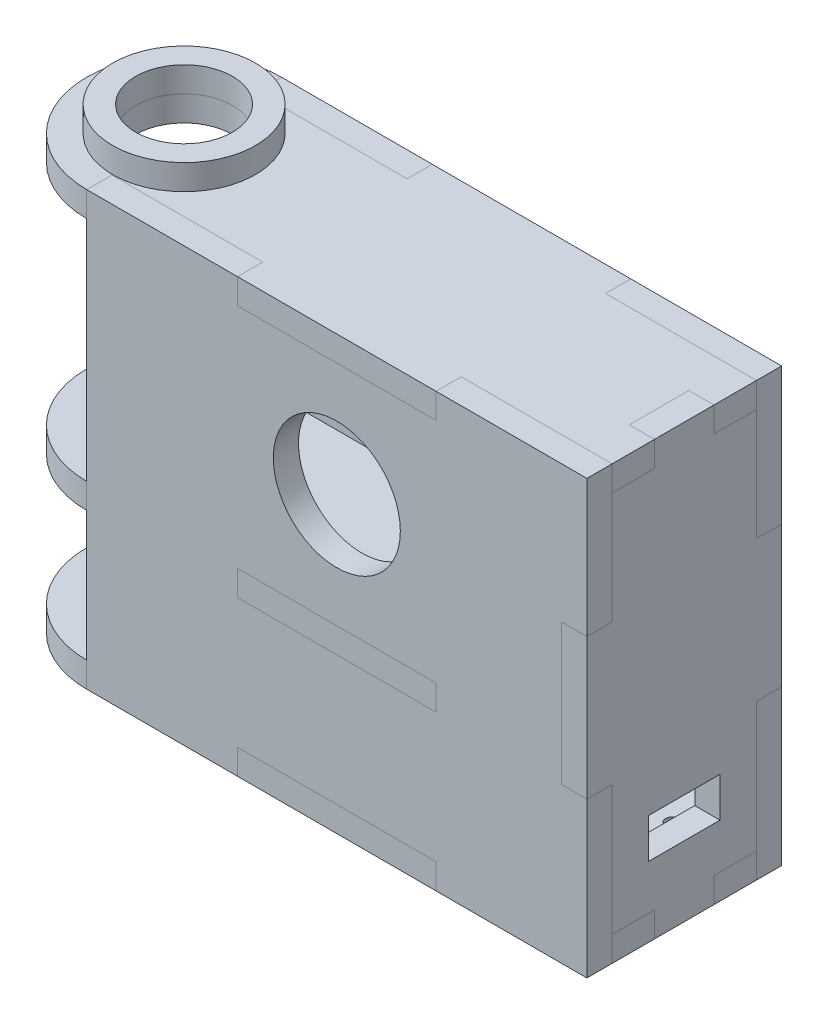
from build123d import *

# Parameters (mm, degrees)
SKETCH_3_R               = 8
EXTRUDE_2_DEPTH          = 3.175
PATTERN_LINEAR_1_COUNT   = 2
PATTERN_LINEAR_1_PITCH   = 21.35
SKETCH_4_W               = 25
SKETCH_4_H               = 3.175
CUT_EXTRUDE_1_DEPTH      = 55.430925263
SKETCH_5_W               = 25
SKETCH_5_H               = 3.175
EXTRUDE_3_DEPTH          = 3.175
EXTRUDE_4_DEPTH          = 3.175
SKETCH_7_W               = 25
SKETCH_7_H               = 3.175
SKETCH_7_W_2             = 3.175
SKETCH_7_H_2             = 5.3375
EXTRUDE_5_DEPTH          = 3.175
EXTRUDE_6_DEPTH          = 3.175
SKETCH_12_R              = 0.795
SKETCH_12_W              = 35.7
SKETCH_12_H              = 15.2
CUT_EXTRUDE_2_DEPTH      = 74.083711634
SKETCH_14_R              = 0.795
SKETCH_14_W              = 35.7
SKETCH_14_H              = 15.2
EXTRUDE_9_DEPTH          = 3.175
SKETCH_9_R               = 9
EXTRUDE_7_DEPTH          = 3.175
SKETCH_10_R              = 9
EXTRUDE_8_DEPTH          = 3.175
SKETCH_15_R              = 6.1
CUT_EXTRUDE_3_DEPTH      = 78.933955413
CUT_EXTRUDE_4_DEPTH      = 88.944852216
CUT_EXTRUDE_4_DEPTH_BACK = 88.944852216
SKETCH_16_W              = 9
SKETCH_16_H              = 5


with BuildPart() as part:
    # 草图3 → 凸台-拉伸2 (new body)
    with BuildSketch(Plane.XY):
        Polygon((31.5, 0.25), (31.5, 17.5), (12.5, 17.5), (12.5, 14.325), (-12.5, 14.325), (-12.5, 17.5), (-31.5, 17.5), (-31.5, -37), (-12.5, -37), (-12.5, -33.825), (12.5, -33.825), (12.5, -37), (31.5, -37), (31.5, -17.5), (28.325, -17.5), (28.325, 0.25), align=None)
        Circle(SKETCH_3_R, mode=Mode.SUBTRACT)
    extrude(amount=EXTRUDE_2_DEPTH)


with BuildPart() as pattern_linear_1_1:
    # 阵列(线性)1: pattern copy
    add(part.part.moved(Location(Vector(0, 0, -1) * (1 * PATTERN_LINEAR_1_PITCH))))


with BuildPart() as cut_extrude_1_tool:
    # 草图4 → 切除-拉伸1 (new, through all)
    with BuildSketch(Plane(origin=(0, 0, -21.35), x_dir=(-1, 0, 0), z_dir=(0, 0, -1))):
        with Locations((0, -15.9125)):
            Rectangle(SKETCH_4_W, SKETCH_4_H)
    extrude(amount=-CUT_EXTRUDE_1_DEPTH)


with BuildPart() as part_1:
    add(part.part)

    # 切除-拉伸1: cut by cut_extrude_1_tool
    add(cut_extrude_1_tool.part, mode=Mode.SUBTRACT)


with BuildPart() as pattern_linear_1_1_1:
    add(pattern_linear_1_1.part)

    # 切除-拉伸1: cut by cut_extrude_1_tool
    add(cut_extrude_1_tool.part, mode=Mode.SUBTRACT)


with BuildPart() as body_3:
    # 草图5 → 凸台-拉伸3 (new body)
    with BuildSketch(Plane(origin=(0, 14.325, 0), x_dir=(1, 0, 0), z_dir=(0, 1, 0))):
        Polygon((-12.5, 18.175), (-31.5, 18.175), (-31.5, 0), (-12.5, 0), (12.5, 0), (31.5, 0), (31.5, 5.3375), (28.325, 5.3375), (28.325, 12.8375), (31.5, 12.8375), (31.5, 18.175), (12.5, 18.175), align=None)
        with BuildLine():
            ThreePointArc((-31.5, -3.175), (-43.7625, 9.0875), (-31.5, 21.35))
            Line((-31.5, 21.35), (-31.5, -3.175))
        make_face()
        with Locations((0, 19.7625)):
            Rectangle(SKETCH_5_W, SKETCH_5_H)
        with Locations((0, -1.5875)):
            Rectangle(SKETCH_5_W, SKETCH_5_H)
    extrude(amount=EXTRUDE_3_DEPTH)


with BuildPart() as body_4:
    # 草图6 → 凸台-拉伸4 (new body)
    with BuildSketch(Plane.XZ.offset(14.325)):
        with BuildLine():
            Line((28.325, 0), (12.5, 0))
            Line((12.5, 0), (12.5, 3.175))
            Line((12.5, 3.175), (-12.5, 3.175))
            Line((-12.5, 3.175), (-12.5, 0))
            Line((-12.5, 0), (-31.5, 0))
            Line((-31.5, 0), (-31.5, 3.175))
            ThreePointArc((-31.5, 3.175), (-43.7625, -9.0875), (-31.5, -21.35))
            Line((-31.5, -21.35), (-31.5, -18.175))
            Line((-31.5, -18.175), (-12.5, -18.175))
            Line((-12.5, -18.175), (-12.5, -21.35))
            Line((-12.5, -21.35), (12.5, -21.35))
            Line((12.5, -21.35), (12.5, -18.175))
            Line((12.5, -18.175), (28.325, -18.175))
            Line((28.325, -18.175), (28.325, 0))
        make_face()
    extrude(amount=EXTRUDE_4_DEPTH)


with BuildPart() as body_5:
    # 草图7 → 凸台-拉伸5 (new body)
    with BuildSketch(Plane.XZ.offset(33.825)):
        with BuildLine():
            Line((-31.5, 0), (-31.5, 3.175))
            ThreePointArc((-31.5, 3.175), (-43.7625, -9.0875), (-31.5, -21.35))
            Line((-31.5, -21.35), (-31.5, -18.175))
            Line((-31.5, -18.175), (-12.5, -18.175))
            Line((-12.5, -18.175), (-12.5, -21.35))
            Line((-12.5, -21.35), (12.5, -21.35))
            Line((12.5, -21.35), (12.5, -18.175))
            Line((12.5, -18.175), (28.325, -18.175))
            Line((28.325, -18.175), (28.325, 0))
            Line((28.325, 0), (12.5, 0))
            Line((12.5, 0), (-12.5, 0))
            Line((-12.5, 0), (-31.5, 0))
        make_face()
        with Locations((0, 1.5875)):
            Rectangle(SKETCH_7_W, SKETCH_7_H)
        with Locations((29.9125, -2.66875)):
            Rectangle(SKETCH_7_W_2, SKETCH_7_H_2)
        with Locations((29.9125, -15.50625)):
            Rectangle(SKETCH_7_W_2, SKETCH_7_H_2)
    extrude(amount=EXTRUDE_5_DEPTH)

    # 草图12 → 切除-拉伸2 (cut, through all)
    with BuildSketch(Plane.XZ.offset(37)):
        with Locations(Location((26.204472492, -5.3375, 0), (0, 0, 270))):
            Circle(SKETCH_12_R)
        with Locations(Location((26.204472492, -12.8375, 0), (0, 0, 270))):
            Circle(SKETCH_12_R)
        with Locations(Location((-16.395527508, -12.8375, 0), (0, 0, 270))):
            Circle(SKETCH_12_R)
        with Locations(Location((-16.395527508, -5.3375, 0), (0, 0, 270))):
            Circle(SKETCH_12_R)
        with Locations((4.904472492, -9.0875)):
            Rectangle(SKETCH_12_W, SKETCH_12_H)
    extrude(amount=-CUT_EXTRUDE_2_DEPTH, mode=Mode.SUBTRACT)


with BuildPart() as body_6:
    # 草图8 → 凸台-拉伸6 (new body)
    with BuildSketch(Plane(origin=(28.325, 0, 0), x_dir=(0, 0, -1), z_dir=(1, 0, 0))):
        Polygon((12.8375, -37), (12.8375, -33.825), (18.175, -33.825), (18.175, -17.5), (21.35, -17.5), (21.35, 0.25), (18.175, 0.25), (18.175, 14.325), (12.8375, 14.325), (12.8375, 17.5), (5.3375, 17.5), (5.3375, 14.325), (0, 14.325), (0, 0.25), (-3.175, 0.25), (-3.175, -17.5), (0, -17.5), (0, -33.825), (5.3375, -33.825), (5.3375, -37), align=None)
    extrude(amount=EXTRUDE_6_DEPTH)

    # 草图16 → 切除-拉伸4 (cut, two sides: drawn at the far end of the back side and taken through both)
    with BuildSketch(Plane(origin=(31.5, 0, 0), x_dir=(0, 0, -1), z_dir=(1, 0, 0)).offset(-CUT_EXTRUDE_4_DEPTH_BACK)):
        with Locations((9.0875, -25.6625)):
            Rectangle(SKETCH_16_W, SKETCH_16_H)
    extrude(amount=CUT_EXTRUDE_4_DEPTH + CUT_EXTRUDE_4_DEPTH_BACK, mode=Mode.SUBTRACT)


with BuildPart() as body_7:
    # 草图14 → 凸台-拉伸9 (new body)
    with BuildSketch(Plane(origin=(0, -33.825, 0), x_dir=(1, 0, 0), z_dir=(0, 1, 0))):
        Polygon((28.325, 12.8375), (28.325, 18.175), (12.5, 18.175), (-12.5, 18.175), (-18.516055016, 18.175), (-18.516055016, 12.8375), (-18.516055016, 5.3375), (-18.516055016, 0), (-12.5, 0), (12.5, 0), (28.325, 0), (28.325, 5.3375), align=None)
        with Locations(Location((-16.395527508, 5.3375, 0), (0, 0, 270))):
            Circle(SKETCH_14_R, mode=Mode.SUBTRACT)
        with Locations((4.904472492, 9.0875)):
            Rectangle(SKETCH_14_W, SKETCH_14_H, mode=Mode.SUBTRACT)
        with Locations(Location((26.204472492, 5.3375, 0), (0, 0, 270))):
            Circle(SKETCH_14_R, mode=Mode.SUBTRACT)
        with Locations(Location((-16.395527508, 12.8375, 0), (0, 0, 270))):
            Circle(SKETCH_14_R, mode=Mode.SUBTRACT)
        with Locations(Location((26.204472492, 12.8375, 0), (0, 0, 270))):
            Circle(SKETCH_14_R, mode=Mode.SUBTRACT)
    extrude(amount=EXTRUDE_9_DEPTH)


with BuildPart() as body_8:
    # 草图9 → 凸台-拉伸7 (new body)
    with BuildSketch(Plane(origin=(0, 17.5, 0), x_dir=(1, 0, 0), z_dir=(0, 1, 0))):
        with Locations(Location((-31.5, 9.0875, 0), (0, 0, 180))):
            Circle(SKETCH_9_R)
    extrude(amount=EXTRUDE_7_DEPTH)


with BuildPart() as body_9:
    # 草图10 → 凸台-拉伸8 (new body)
    with BuildSketch(Plane.XZ.offset(37)):
        with Locations(Location((-31.5, -9.0875, 0), (0, 0, 270))):
            Circle(SKETCH_10_R)
    extrude(amount=EXTRUDE_8_DEPTH)


with BuildPart() as cut_extrude_3_tool:
    # 草图15 → 切除-拉伸3 (new, through all)
    with BuildSketch(Plane(origin=(0, 20.675, 0), x_dir=(1, 0, 0), z_dir=(0, 1, 0))):
        with Locations(Location((-31.5, 9.0875, 0), (0, 0, 180))):
            Circle(SKETCH_15_R)
    extrude(amount=-CUT_EXTRUDE_3_DEPTH)


with BuildPart() as body_3_1:
    add(body_3.part)

    # 切除-拉伸3: cut by cut_extrude_3_tool
    add(cut_extrude_3_tool.part, mode=Mode.SUBTRACT)


with BuildPart() as body_4_1:
    add(body_4.part)

    # 切除-拉伸3: cut by cut_extrude_3_tool
    add(cut_extrude_3_tool.part, mode=Mode.SUBTRACT)


with BuildPart() as body_5_1:
    add(body_5.part)

    # 切除-拉伸3: cut by cut_extrude_3_tool
    add(cut_extrude_3_tool.part, mode=Mode.SUBTRACT)


with BuildPart() as body_8_1:
    add(body_8.part)

    # 切除-拉伸3: cut by cut_extrude_3_tool
    add(cut_extrude_3_tool.part, mode=Mode.SUBTRACT)


with BuildPart() as body_9_1:
    add(body_9.part)

    # 切除-拉伸3: cut by cut_extrude_3_tool
    add(cut_extrude_3_tool.part, mode=Mode.SUBTRACT)


solid = Compound([part_1.part, pattern_linear_1_1_1.part, body_6.part, body_7.part, body_3_1.part, body_4_1.part, body_5_1.part, body_8_1.part, body_9_1.part])
